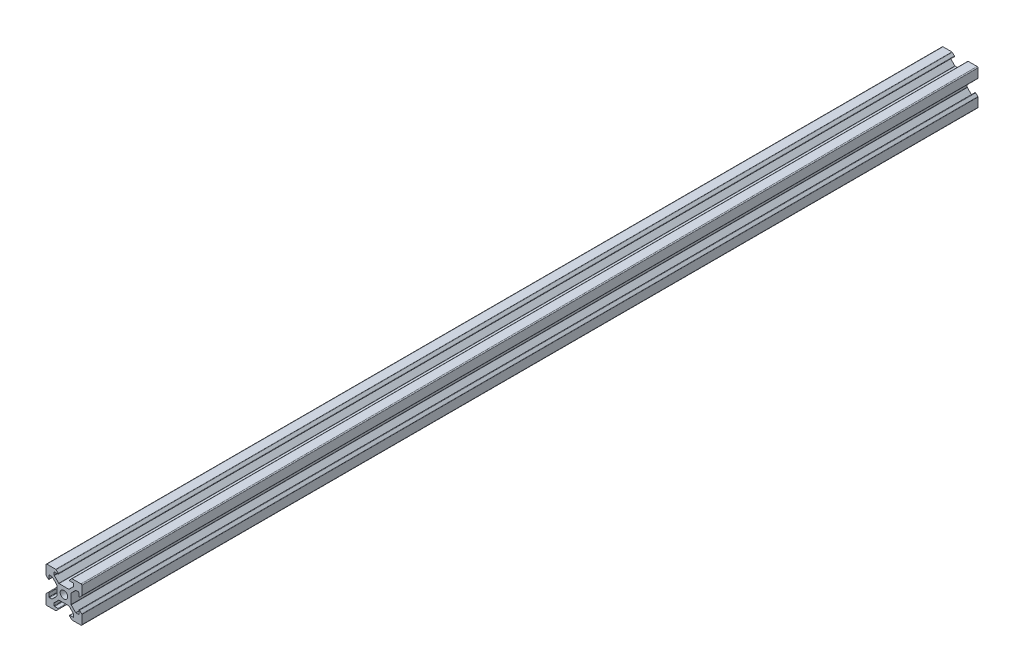
from build123d import *

# Parameters (mm, degrees)
MODEL_R             = 2.1
BOSS_EXTRUDE1_DEPTH = 500


with BuildPart() as part:
    # Model → Boss-Extrude1 (new body)
    with BuildSketch(Plane.XY):
        with BuildLine():
            Line((2012.931211125, 1381.800393717), (2012.931211125, 1378.200393717))
            Line((2012.931211125, 1378.200393717), (2012.931211125, 1377.300429431))
            ThreePointArc((2012.931211125, 1377.300429431), (2012.908374985, 1377.185624401), (2012.843343159, 1377.088297396))
            Line((2012.843343159, 1377.088297396), (2010.378662785, 1374.623617022))
            ThreePointArc((2010.378662785, 1374.623617022), (2010.297556948, 1374.569423834), (2010.20188609, 1374.550393717))
            Line((2010.20188609, 1374.550393717), (2008.881211125, 1374.550393717))
            ThreePointArc((2008.881211125, 1374.550393717), (2008.70443443, 1374.623617022), (2008.631211125, 1374.800393717))
            Line((2008.631211125, 1374.800393717), (2008.631211125, 1376.650393717))
            ThreePointArc((2008.631211125, 1376.650393717), (2008.476881983, 1376.8813636), (2008.20443443, 1376.827170412))
            Line((2008.20443443, 1376.827170412), (2007.01907909, 1375.641815073))
            ThreePointArc((2007.01907909, 1375.641815073), (2006.954047265, 1375.544488069), (2006.931211125, 1375.429683039))
            Line((2006.931211125, 1375.429683039), (2006.931211125, 1370.500393717))
            ThreePointArc((2006.931211125, 1370.500393717), (2007.077657734, 1370.146840327), (2007.431211125, 1370.000393717))
            Line((2007.431211125, 1370.000393717), (2012.360500447, 1370.000393717))
            ThreePointArc((2012.360500447, 1370.000393717), (2012.475305476, 1370.023229857), (2012.572632481, 1370.088261683))
            Line((2012.572632481, 1370.088261683), (2013.75798782, 1371.273617022))
            ThreePointArc((2013.75798782, 1371.273617022), (2013.812181008, 1371.546064575), (2013.581211125, 1371.700393717))
            Line((2013.581211125, 1371.700393717), (2011.731211125, 1371.700393717))
            ThreePointArc((2011.731211125, 1371.700393717), (2011.55443443, 1371.773617022), (2011.481211125, 1371.950393717))
            Line((2011.481211125, 1371.950393717), (2011.481211125, 1373.271068682))
            ThreePointArc((2011.481211125, 1373.271068682), (2011.500241242, 1373.36673954), (2011.55443443, 1373.447845377))
            Line((2011.55443443, 1373.447845377), (2014.033759465, 1375.927170412))
            ThreePointArc((2014.033759465, 1375.927170412), (2014.114865302, 1375.9813636), (2014.21053616, 1376.000393717))
            Line((2014.21053616, 1376.000393717), (2016.470233902, 1376.000393717))
            Line((2016.470233902, 1376.000393717), (2017.392188348, 1376.000393717))
            Line((2017.392188348, 1376.000393717), (2019.65188609, 1376.000393717))
            ThreePointArc((2019.65188609, 1376.000393717), (2019.747556948, 1375.9813636), (2019.828662785, 1375.927170412))
            Line((2019.828662785, 1375.927170412), (2022.30798782, 1373.447845377))
            ThreePointArc((2022.30798782, 1373.447845377), (2022.362181008, 1373.36673954), (2022.381211125, 1373.271068682))
            Line((2022.381211125, 1373.271068682), (2022.381211125, 1371.950393717))
            ThreePointArc((2022.381211125, 1371.950393717), (2022.30798782, 1371.773617022), (2022.131211125, 1371.700393717))
            Line((2022.131211125, 1371.700393717), (2020.281211125, 1371.700393717))
            ThreePointArc((2020.281211125, 1371.700393717), (2020.050241242, 1371.546064575), (2020.10443443, 1371.273617022))
            Line((2020.10443443, 1371.273617022), (2021.289789769, 1370.088261683))
            ThreePointArc((2021.289789769, 1370.088261683), (2021.387116773, 1370.023229857), (2021.501921803, 1370.000393717))
            Line((2021.501921803, 1370.000393717), (2026.431211125, 1370.000393717))
            ThreePointArc((2026.431211125, 1370.000393717), (2026.784764515, 1370.146840327), (2026.931211125, 1370.500393717))
            Line((2026.931211125, 1370.500393717), (2026.931211125, 1375.429683039))
            ThreePointArc((2026.931211125, 1375.429683039), (2026.908374985, 1375.544488069), (2026.843343159, 1375.641815073))
            Line((2026.843343159, 1375.641815073), (2025.65798782, 1376.827170412))
            ThreePointArc((2025.65798782, 1376.827170412), (2025.385540267, 1376.8813636), (2025.231211125, 1376.650393717))
            Line((2025.231211125, 1376.650393717), (2025.231211125, 1374.800393717))
            ThreePointArc((2025.231211125, 1374.800393717), (2025.15798782, 1374.623617022), (2024.981211125, 1374.550393717))
            Line((2024.981211125, 1374.550393717), (2023.66053616, 1374.550393717))
            ThreePointArc((2023.66053616, 1374.550393717), (2023.564865302, 1374.569423834), (2023.483759465, 1374.623617022))
            Line((2023.483759465, 1374.623617022), (2021.00443443, 1377.102942057))
            ThreePointArc((2021.00443443, 1377.102942057), (2020.950241242, 1377.184047894), (2020.931211125, 1377.279718752))
            Line((2020.931211125, 1377.279718752), (2020.931211125, 1379.539416494))
            Line((2020.931211125, 1379.539416494), (2020.931211125, 1380.46137094))
            Line((2020.931211125, 1380.46137094), (2020.931211125, 1382.721068682))
            ThreePointArc((2020.931211125, 1382.721068682), (2020.950241242, 1382.81673954), (2021.00443443, 1382.897845377))
            Line((2021.00443443, 1382.897845377), (2023.483759465, 1385.377170412))
            ThreePointArc((2023.483759465, 1385.377170412), (2023.564865302, 1385.4313636), (2023.66053616, 1385.450393717))
            Line((2023.66053616, 1385.450393717), (2024.981211125, 1385.450393717))
            ThreePointArc((2024.981211125, 1385.450393717), (2025.15798782, 1385.377170412), (2025.231211125, 1385.200393717))
            Line((2025.231211125, 1385.200393717), (2025.231211125, 1383.350393717))
            ThreePointArc((2025.231211125, 1383.350393717), (2025.385540267, 1383.119423834), (2025.65798782, 1383.173617022))
            Line((2025.65798782, 1383.173617022), (2026.843343159, 1384.358972361))
            ThreePointArc((2026.843343159, 1384.358972361), (2026.908374985, 1384.456299366), (2026.931211125, 1384.571104395))
            Line((2026.931211125, 1384.571104395), (2026.931211125, 1389.500393717))
            ThreePointArc((2026.931211125, 1389.500393717), (2026.784764516, 1389.853947108), (2026.431211125, 1390.000393717))
            Line((2026.431211125, 1390.000393717), (2021.501921803, 1390.000393717))
            ThreePointArc((2021.501921803, 1390.000393717), (2021.387116773, 1389.977557577), (2021.289789769, 1389.912525752))
            Line((2021.289789769, 1389.912525752), (2020.10443443, 1388.727170413))
            ThreePointArc((2020.10443443, 1388.727170413), (2020.050241242, 1388.454722859), (2020.281211125, 1388.300393717))
            Line((2020.281211125, 1388.300393717), (2022.131211125, 1388.300393717))
            ThreePointArc((2022.131211125, 1388.300393717), (2022.30798782, 1388.227170413), (2022.381211125, 1388.050393717))
            Line((2022.381211125, 1388.050393717), (2022.381211125, 1386.729718752))
            ThreePointArc((2022.381211125, 1386.729718752), (2022.362181008, 1386.634047894), (2022.30798782, 1386.552942057))
            Line((2022.30798782, 1386.552942057), (2019.828662785, 1384.073617022))
            ThreePointArc((2019.828662785, 1384.073617022), (2019.747556948, 1384.019423834), (2019.65188609, 1384.000393717))
            Line((2019.65188609, 1384.000393717), (2017.392188348, 1384.000393717))
            Line((2017.392188348, 1384.000393717), (2016.470233902, 1384.000393717))
            Line((2016.470233902, 1384.000393717), (2014.21053616, 1384.000393717))
            ThreePointArc((2014.21053616, 1384.000393717), (2014.114865302, 1384.019423834), (2014.033759465, 1384.073617022))
            Line((2014.033759465, 1384.073617022), (2011.55443443, 1386.552942057))
            ThreePointArc((2011.55443443, 1386.552942057), (2011.500241242, 1386.634047894), (2011.481211125, 1386.729718752))
            Line((2011.481211125, 1386.729718752), (2011.481211125, 1388.050393717))
            ThreePointArc((2011.481211125, 1388.050393717), (2011.55443443, 1388.227170413), (2011.731211125, 1388.300393717))
            Line((2011.731211125, 1388.300393717), (2013.581211125, 1388.300393717))
            ThreePointArc((2013.581211125, 1388.300393717), (2013.812181008, 1388.454722859), (2013.75798782, 1388.727170413))
            Line((2013.75798782, 1388.727170413), (2012.572632481, 1389.912525752))
            ThreePointArc((2012.572632481, 1389.912525752), (2012.475305477, 1389.977557577), (2012.360500447, 1390.000393717))
            Line((2012.360500447, 1390.000393717), (2007.431211125, 1390.000393717))
            ThreePointArc((2007.431211125, 1390.000393717), (2007.077657734, 1389.853947108), (2006.931211125, 1389.500393717))
            Line((2006.931211125, 1389.500393717), (2006.931211125, 1384.571104395))
            ThreePointArc((2006.931211125, 1384.571104395), (2006.954047265, 1384.456299366), (2007.019079091, 1384.358972361))
            Line((2007.019079091, 1384.358972361), (2008.20443443, 1383.173617022))
            ThreePointArc((2008.20443443, 1383.173617022), (2008.476881983, 1383.119423834), (2008.631211125, 1383.350393717))
            Line((2008.631211125, 1383.350393717), (2008.631211125, 1385.200393717))
            ThreePointArc((2008.631211125, 1385.200393717), (2008.70443443, 1385.377170412), (2008.881211125, 1385.450393717))
            Line((2008.881211125, 1385.450393717), (2010.20188609, 1385.450393717))
            ThreePointArc((2010.20188609, 1385.450393717), (2010.297556948, 1385.4313636), (2010.378662785, 1385.377170412))
            Line((2010.378662785, 1385.377170412), (2012.843343159, 1382.912490038))
            ThreePointArc((2012.843343159, 1382.912490038), (2012.908374985, 1382.815163033), (2012.931211125, 1382.700358004))
            Line((2012.931211125, 1382.700358004), (2012.931211125, 1381.800393717))
        make_face()
        with Locations((2016.931211125, 1380.000393717)):
            Circle(MODEL_R, mode=Mode.SUBTRACT)
    extrude(amount=BOSS_EXTRUDE1_DEPTH)


solid = part.part
